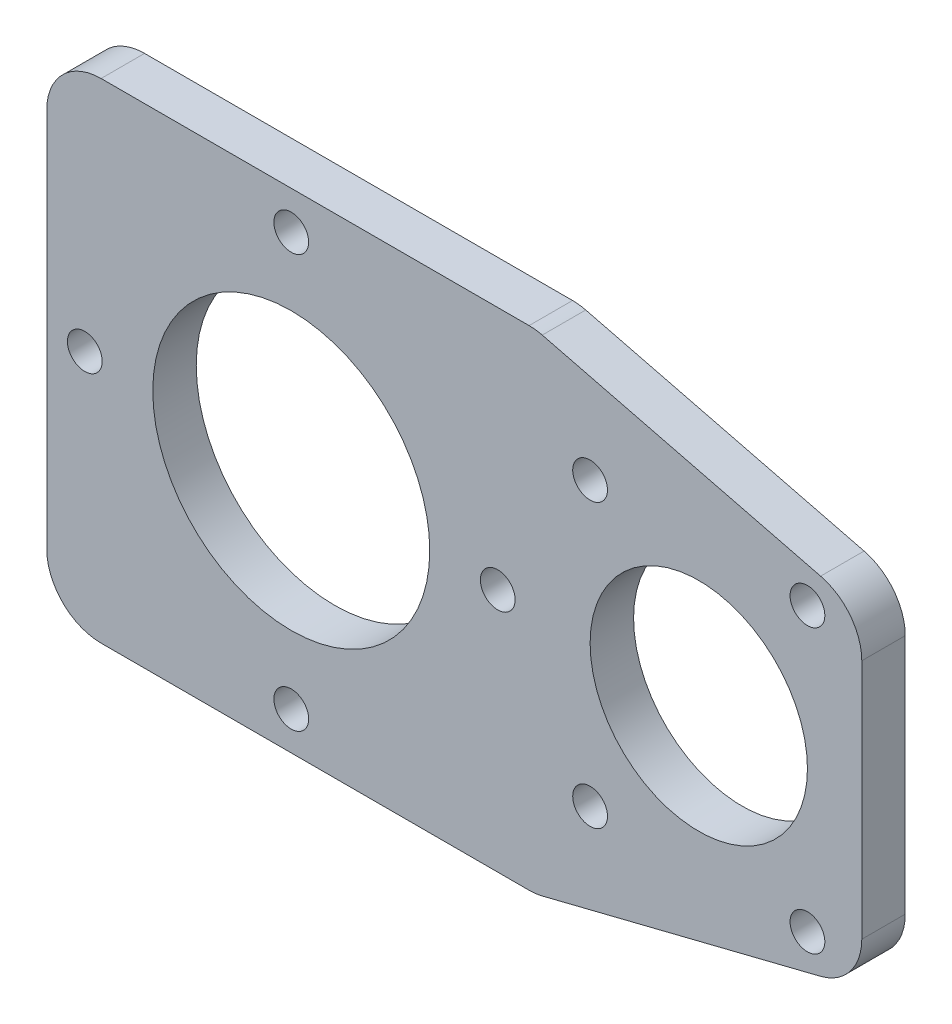
from build123d import *

# Parameters (mm, degrees)
SKETCH_1_W          = 45
SKETCH_1_H          = 45
SKETCH_1_R          = 1.6
EXTRUDE_1_DEPTH     = 4
EXTRUDE_2_DEPTH     = 4
SKETCH_3_R          = 1.6
CUT_EXTRUDE_1_DEPTH = 4
FILLET_1_R          = 5
SKETCH_4_R          = 1.6
CUT_EXTRUDE_2_DEPTH = 4
SKETCH_5_R          = 12.744189695
SKETCH_5_R_2        = 10
CUT_EXTRUDE_3_DEPTH = 10
FILLET_2_R          = 5
FILLET_3_R          = 5


with BuildPart() as part:
    # 草图1 → 凸台-拉伸1 (new body)
    with BuildSketch(Plane.XY):
        Rectangle(SKETCH_1_W, SKETCH_1_H)
        with Locations((19, 0)):
            Circle(SKETCH_1_R, mode=Mode.SUBTRACT)
        with Locations(Location((-19, 0, 0), (0, 0, 180))):
            Circle(SKETCH_1_R, mode=Mode.SUBTRACT)
    extrude(amount=EXTRUDE_1_DEPTH)

    # 草图2 → 凸台-拉伸2 (add)
    with BuildSketch(Plane.XY.offset(4)):
        Polygon((52.5, 15), (22.5, 22.5), (22.5, 0), (52.5, 0), align=None)
        Polygon((52.5, 0), (22.5, 0), (22.5, -22.5), (52.5, -15), align=None)
    extrude(amount=-EXTRUDE_2_DEPTH)

    # 草图3 → 切除-拉伸1 (cut)
    with BuildSketch(Plane.XY.offset(4)):
        with Locations((27.5, 13)):
            Circle(SKETCH_3_R)
        with Locations((47.5, 13)):
            Circle(SKETCH_3_R)
        with Locations(Location((47.5, -13, 0), (0, 0, 180))):
            Circle(SKETCH_3_R)
        with Locations(Location((27.5, -13, 0), (0, 0, 180))):
            Circle(SKETCH_3_R)
    extrude(amount=-CUT_EXTRUDE_1_DEPTH, mode=Mode.SUBTRACT)

    # 圆角1
    fillet_1_edges = [part.edges().sort_by_distance(p)[0] for p in [
        (52.5, 15, 2),
        (52.5, -15, 2),
        (22.5, 22.5, 2),
    ]]
    fillet(fillet_1_edges, radius=FILLET_1_R)

    # 草图4 → 切除-拉伸2 (cut)
    with BuildSketch(Plane.XY.offset(4)):
        with Locations((0, 19)):
            Circle(SKETCH_4_R)
        with Locations(Location((0, -19, 0), (0, 0, 180))):
            Circle(SKETCH_4_R)
    extrude(amount=-CUT_EXTRUDE_2_DEPTH, mode=Mode.SUBTRACT)

    # 草图5 → 切除-拉伸3 (cut)
    with BuildSketch(Plane.XY.offset(4)):
        Circle(SKETCH_5_R)
        with Locations((37.5, 0)):
            Circle(SKETCH_5_R_2)
    extrude(amount=-CUT_EXTRUDE_3_DEPTH, mode=Mode.SUBTRACT)

    # 圆角2
    fillet_2_edges = [part.edges().sort_by_distance(p)[0] for p in [
        (-22.5, -22.5, 2),
        (-22.5, 22.5, 2),
    ]]
    fillet(fillet_2_edges, radius=FILLET_2_R)

    # 圆角3
    fillet_3_edges = [part.edges().sort_by_distance(p)[0] for p in [
        (22.5, -22.5, 2),
    ]]
    fillet(fillet_3_edges, radius=FILLET_3_R)


solid = part.part
